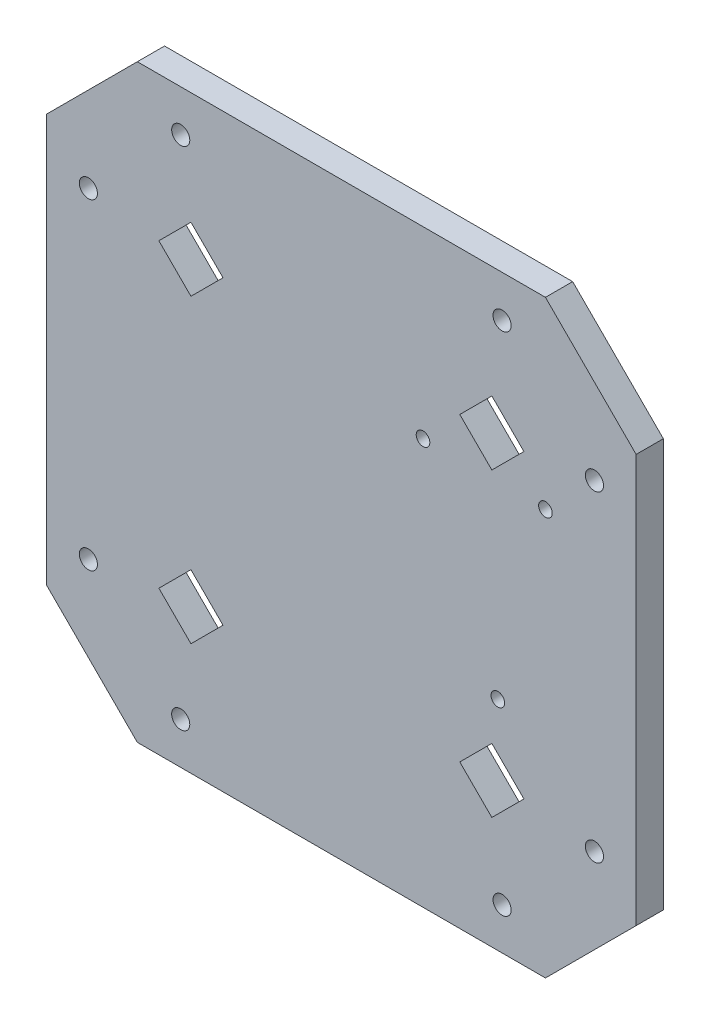
from build123d import *

# Parameters (mm, degrees)
SKETCH_1_W          = 130
SKETCH_1_H          = 130
EXTRUDE_1_DEPTH     = 6
CUT_EXTRUDE_1_DEPTH = 6
CUT_EXTRUDE_2_REACH = 185.946
SKETCH_11_R         = 2
CHAMFER_1_SIZE      = 20
CUT_EXTRUDE_3_REACH = 185.946
SKETCH_12_R         = 1.5
SKETCH_13_R         = 4
SKETCH_13_R_2       = 1.5
EXTRUDE_2_DEPTH     = 5


with BuildPart() as part:
    # 草圖1 → 填料-伸長1 (new body)
    with BuildSketch(Plane.XY):
        with Locations((-65, 65)):
            Rectangle(SKETCH_1_W, SKETCH_1_H)
    extrude(amount=EXTRUDE_1_DEPTH)

    # 草圖10 → 除料-伸長1 (cut)
    with BuildSketch(Plane.XY.offset(6)):
        Polygon((-38.890872965, 98.180194847), (-31.819805153, 105.251262658), (-24.748737342, 98.180194847), (-31.819805153, 91.109127035), align=None)
        Polygon((-98.180194847, 105.251262658), (-105.251262658, 98.180194847), (-98.180194847, 91.109127035), (-91.109127035, 98.180194847), align=None)
        Polygon((-91.109127035, 31.819805153), (-98.180194847, 24.748737342), (-105.251262658, 31.819805153), (-98.180194847, 38.890872965), align=None)
        Polygon((-31.819805153, 24.748737342), (-24.748737342, 31.819805153), (-31.819805153, 38.890872965), (-38.890872965, 31.819805153), align=None)
    extrude(amount=-CUT_EXTRUDE_1_DEPTH, mode=Mode.SUBTRACT)

    # 草圖11 → 除料-伸長2 (cut, up to next)
    with BuildSketch(Plane.XY.offset(6), mode=Mode.PRIVATE) as cut_extrude_2_sk1:
        with Locations((-9.2, 100.435324702)):
            Circle(SKETCH_11_R)
    cut_extrude_2_tool1 = extrude(cut_extrude_2_sk1.sketch, amount=-CUT_EXTRUDE_2_REACH, mode=Mode.PRIVATE) & part.part
    # 草圖11 → 除料-伸長2 (cut, up to next)
    with BuildSketch(Plane.XY.offset(6), mode=Mode.PRIVATE) as cut_extrude_2_sk2:
        with Locations((-29.564675298, 120.8)):
            Circle(SKETCH_11_R)
    cut_extrude_2_tool2 = extrude(cut_extrude_2_sk2.sketch, amount=-CUT_EXTRUDE_2_REACH, mode=Mode.PRIVATE) & part.part
    # 草圖11 → 除料-伸長2 (cut, up to next)
    with BuildSketch(Plane.XY.offset(6), mode=Mode.PRIVATE) as cut_extrude_2_sk3:
        with Locations((-100.435324702, 120.8)):
            Circle(SKETCH_11_R)
    cut_extrude_2_tool3 = extrude(cut_extrude_2_sk3.sketch, amount=-CUT_EXTRUDE_2_REACH, mode=Mode.PRIVATE) & part.part
    # 草圖11 → 除料-伸長2 (cut, up to next)
    with BuildSketch(Plane.XY.offset(6), mode=Mode.PRIVATE) as cut_extrude_2_sk4:
        with Locations((-120.8, 100.435324702)):
            Circle(SKETCH_11_R)
    cut_extrude_2_tool4 = extrude(cut_extrude_2_sk4.sketch, amount=-CUT_EXTRUDE_2_REACH, mode=Mode.PRIVATE) & part.part
    # 草圖11 → 除料-伸長2 (cut, up to next)
    with BuildSketch(Plane.XY.offset(6), mode=Mode.PRIVATE) as cut_extrude_2_sk5:
        with Locations((-120.8, 29.564675298)):
            Circle(SKETCH_11_R)
    cut_extrude_2_tool5 = extrude(cut_extrude_2_sk5.sketch, amount=-CUT_EXTRUDE_2_REACH, mode=Mode.PRIVATE) & part.part
    # 草圖11 → 除料-伸長2 (cut, up to next)
    with BuildSketch(Plane.XY.offset(6), mode=Mode.PRIVATE) as cut_extrude_2_sk6:
        with Locations((-100.435324702, 9.2)):
            Circle(SKETCH_11_R)
    cut_extrude_2_tool6 = extrude(cut_extrude_2_sk6.sketch, amount=-CUT_EXTRUDE_2_REACH, mode=Mode.PRIVATE) & part.part
    # 草圖11 → 除料-伸長2 (cut, up to next)
    with BuildSketch(Plane.XY.offset(6), mode=Mode.PRIVATE) as cut_extrude_2_sk7:
        with Locations((-29.564675298, 9.2)):
            Circle(SKETCH_11_R)
    cut_extrude_2_tool7 = extrude(cut_extrude_2_sk7.sketch, amount=-CUT_EXTRUDE_2_REACH, mode=Mode.PRIVATE) & part.part
    # 草圖11 → 除料-伸長2 (cut, up to next)
    with BuildSketch(Plane.XY.offset(6), mode=Mode.PRIVATE) as cut_extrude_2_sk8:
        with Locations((-9.2, 29.564675298)):
            Circle(SKETCH_11_R)
    cut_extrude_2_tool8 = extrude(cut_extrude_2_sk8.sketch, amount=-CUT_EXTRUDE_2_REACH, mode=Mode.PRIVATE) & part.part
    add(cut_extrude_2_tool1.solids().sort_by_distance((-9.2, 100.435325, 6))[0], mode=Mode.SUBTRACT)
    add(cut_extrude_2_tool2.solids().sort_by_distance((-29.564675, 120.8, 6))[0], mode=Mode.SUBTRACT)
    add(cut_extrude_2_tool3.solids().sort_by_distance((-100.435325, 120.8, 6))[0], mode=Mode.SUBTRACT)
    add(cut_extrude_2_tool4.solids().sort_by_distance((-120.8, 100.435325, 6))[0], mode=Mode.SUBTRACT)
    add(cut_extrude_2_tool5.solids().sort_by_distance((-120.8, 29.564675, 6))[0], mode=Mode.SUBTRACT)
    add(cut_extrude_2_tool6.solids().sort_by_distance((-100.435325, 9.2, 6))[0], mode=Mode.SUBTRACT)
    add(cut_extrude_2_tool7.solids().sort_by_distance((-29.564675, 9.2, 6))[0], mode=Mode.SUBTRACT)
    add(cut_extrude_2_tool8.solids().sort_by_distance((-9.2, 29.564675, 6))[0], mode=Mode.SUBTRACT)

    # 導角1
    chamfer_1_edges = [part.edges().sort_by_distance(p)[0] for p in [
        (-130, 0, 3),
        (-130, 130, 3),
        (0, 130, 3),
        (0, 0, 3),
    ]]
    chamfer(chamfer_1_edges, length=CHAMFER_1_SIZE)

    # 草圖12 → 除料-伸長3 (cut, up to next)
    with BuildSketch(Plane.XY.offset(6), mode=Mode.PRIVATE) as cut_extrude_3_sk1:
        with Locations((-47, 89.5)):
            Circle(SKETCH_12_R)
    cut_extrude_3_tool1 = extrude(cut_extrude_3_sk1.sketch, amount=-CUT_EXTRUDE_3_REACH, mode=Mode.PRIVATE) & part.part
    # 草圖12 → 除料-伸長3 (cut, up to next)
    with BuildSketch(Plane.XY.offset(6), mode=Mode.PRIVATE) as cut_extrude_3_sk2:
        with Locations((-20, 89.5)):
            Circle(SKETCH_12_R)
    cut_extrude_3_tool2 = extrude(cut_extrude_3_sk2.sketch, amount=-CUT_EXTRUDE_3_REACH, mode=Mode.PRIVATE) & part.part
    # 草圖12 → 除料-伸長3 (cut, up to next)
    with BuildSketch(Plane.XY.offset(6), mode=Mode.PRIVATE) as cut_extrude_3_sk3:
        with Locations((-30.5, 48)):
            Circle(SKETCH_12_R)
    cut_extrude_3_tool3 = extrude(cut_extrude_3_sk3.sketch, amount=-CUT_EXTRUDE_3_REACH, mode=Mode.PRIVATE) & part.part
    add(cut_extrude_3_tool1.solids().sort_by_distance((-47, 89.5, 6))[0], mode=Mode.SUBTRACT)
    add(cut_extrude_3_tool2.solids().sort_by_distance((-20, 89.5, 6))[0], mode=Mode.SUBTRACT)
    add(cut_extrude_3_tool3.solids().sort_by_distance((-30.5, 48, 6))[0], mode=Mode.SUBTRACT)

    # 草圖13 → 填料-伸長2 (add)
    # profile 1 of 3: a face of its own
    with BuildSketch(Plane(origin=(0, 0, 0), x_dir=(-1, 0, 0), z_dir=(0, 0, -1))):
        with Locations(Location((20, 89.5, 0), (0, 0, 180))):
            Circle(SKETCH_13_R)
        with Locations(Location((20, 89.5, 0), (0, 0, 180))):
            Circle(SKETCH_13_R_2, mode=Mode.SUBTRACT)
    # profile 2 of 3: a face of its own
    with BuildSketch(Plane(origin=(0, 0, 0), x_dir=(-1, 0, 0), z_dir=(0, 0, -1))):
        with Locations(Location((47, 89.5, 0), (0, 0, 180))):
            Circle(SKETCH_13_R)
        with Locations(Location((47, 89.5, 0), (0, 0, 180))):
            Circle(SKETCH_13_R_2, mode=Mode.SUBTRACT)
    # profile 3 of 3: a face of its own
    with BuildSketch(Plane(origin=(0, 0, 0), x_dir=(-1, 0, 0), z_dir=(0, 0, -1))):
        with Locations(Location((30.5, 48, 0), (0, 0, 180))):
            Circle(SKETCH_13_R)
        with Locations(Location((30.5, 48, 0), (0, 0, 180))):
            Circle(SKETCH_13_R_2, mode=Mode.SUBTRACT)
    extrude(amount=EXTRUDE_2_DEPTH)


solid = part.part
